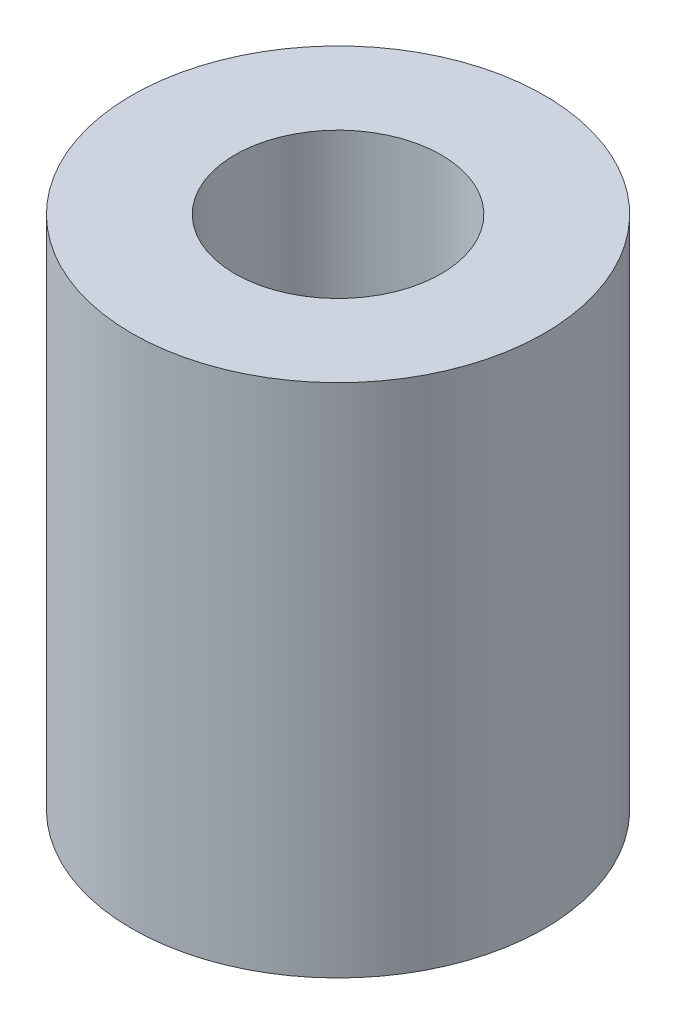
from build123d import *

# Parameters (mm, degrees)
SKETCH_1_R      = 10
SKETCH_1_R_2    = 5
EXTRUDE_1_DEPTH = 25


with BuildPart() as part:
    # Эскиз1 → Бобышка-Вытянуть1 (new body)
    with BuildSketch(Plane(origin=(0, 0, 0), x_dir=(1, 0, 0), z_dir=(0, 1, 0))):
        with Locations(Location((0, 0, 0), (0, 0, 270))):
            Circle(SKETCH_1_R)
        with Locations(Location((0, 0, 0), (0, 0, 270))):
            Circle(SKETCH_1_R_2, mode=Mode.SUBTRACT)
    extrude(amount=EXTRUDE_1_DEPTH)


solid = part.part
